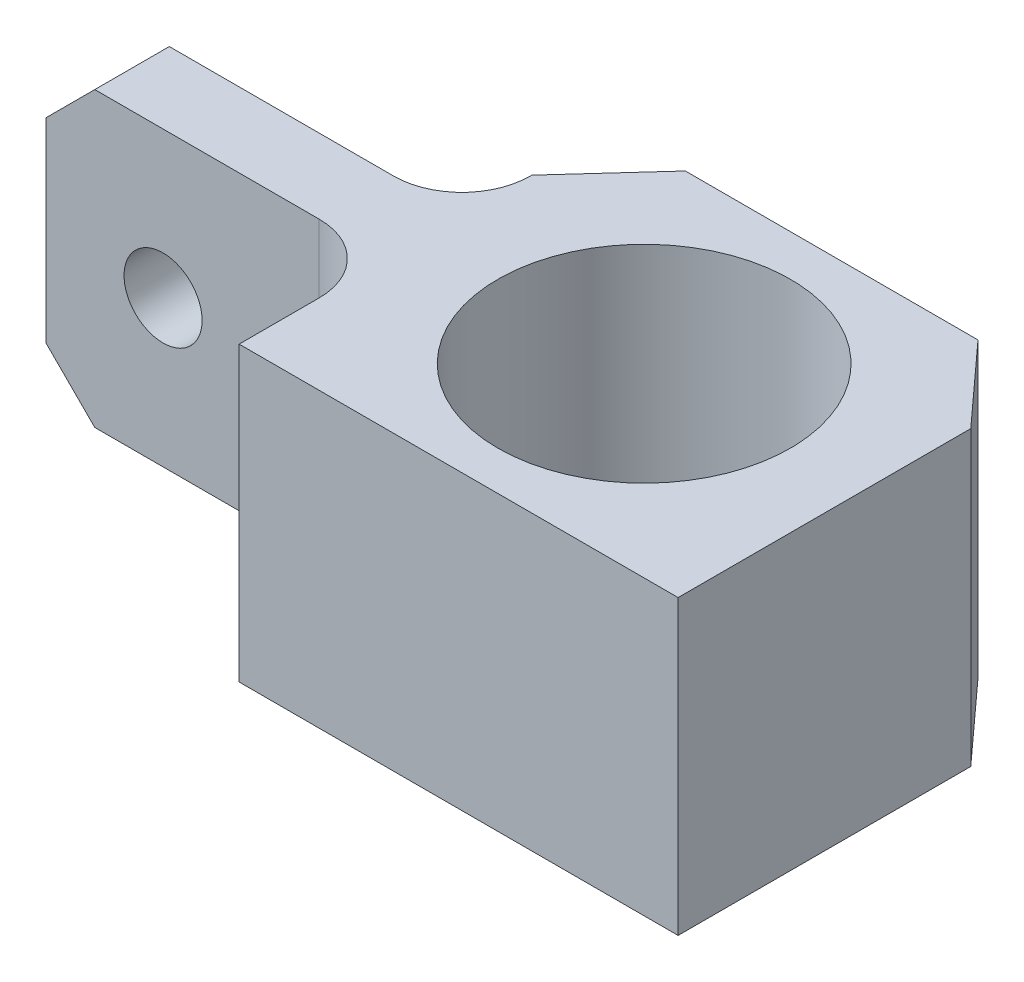
from build123d import *

# Parameters (mm, degrees)
EXTRUDE_1_DEPTH     = 30
SKETCH_2_R          = 15
CUT_EXTRUDE_2_DEPTH = 43.140141425
SKETCH_3_W          = 7.64
SKETCH_3_H          = 30
EXTRUDE_3_DEPTH     = 35
CHAMFER_1_SIZE      = 5
SKETCH_5_R          = 4
CUT_EXTRUDE_4_DEPTH = 69.827691917
FILLET_2_R          = 7
FILLET_3_R          = 7


with BuildPart() as part:
    # Эскиз1 → Вытянуть1 (new body)
    with BuildSketch(Plane(origin=(0, 0, 0), x_dir=(1, 0, 0), z_dir=(0, 1, 0))):
        Polygon((22.5, -19.019063342), (-22.5, -19.019063342), (-22.5, 10.980936658), (-15, 19.22346273), (15, 19.22346273), (22.5, 10.980936658), align=None)
    extrude(amount=EXTRUDE_1_DEPTH)

    # Эскиз2 → Вытянуть2 (cut, through all)
    with BuildSketch(Plane(origin=(0, 30, 0), x_dir=(1, 0, 0), z_dir=(0, 1, 0))):
        with Locations(Location((0, 0, 0), (0, 0, 270))):
            Circle(SKETCH_2_R)
    extrude(amount=-CUT_EXTRUDE_2_DEPTH, mode=Mode.SUBTRACT)

    # Эскиз3 → Вытянуть3 (add)
    with BuildSketch(Plane.ZY.offset(22.5)):
        with Locations((0, 15)):
            Rectangle(SKETCH_3_W, SKETCH_3_H)
    extrude(amount=EXTRUDE_3_DEPTH)

    # Фаска1
    chamfer_1_edges = [part.edges().sort_by_distance(p)[0] for p in [
        (-57.5, 0, 0),
        (-57.5, 30, 0),
    ]]
    chamfer(chamfer_1_edges, length=CHAMFER_1_SIZE)

    # Эскиз5 → Вытянуть4 (cut, through all)
    with BuildSketch(Plane.XY.offset(3.82)):
        with Locations((-45.5, 15)):
            Circle(SKETCH_5_R)
    extrude(amount=-CUT_EXTRUDE_4_DEPTH, mode=Mode.SUBTRACT)

    # Скругление2
    fillet_2_edges = [part.edges().sort_by_distance(p)[0] for p in [
        (-22.5, 15, -3.82),
    ]]
    fillet(fillet_2_edges, radius=FILLET_2_R)

    # Скругление3
    fillet_3_edges = [part.edges().sort_by_distance(p)[0] for p in [
        (-22.5, 15, 3.82),
    ]]
    fillet(fillet_3_edges, radius=FILLET_3_R)


solid = part.part
